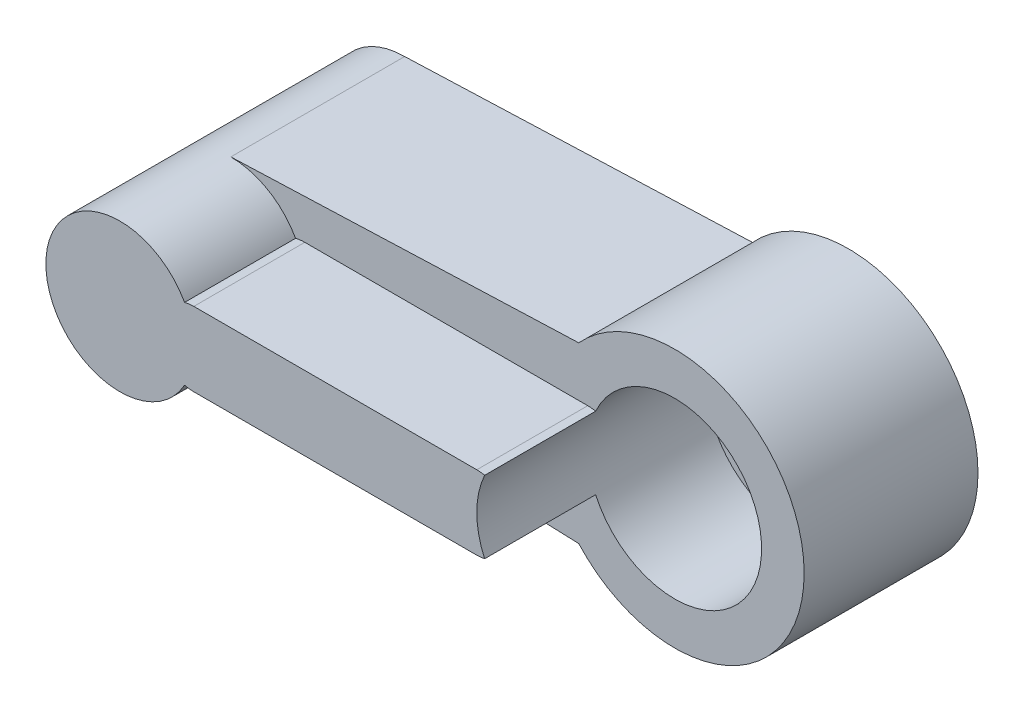
from build123d import *
from build123d.topology import SkipClean

# Parameters (mm, degrees)
SKETCH1_R           = 2.35
BOSS_EXTRUDE1_DEPTH = 6.7
BOSS_EXTRUDE2_DEPTH = 3
CUT_EXTRUDE1_DEPTH  = 2
SKETCH4_R           = 2.35
SKETCH4_R_2         = 1.45
BOSS_EXTRUDE3_DEPTH = 1.5


with BuildPart() as part:
    # Sketch1 → Boss-Extrude1 (new body)
    with BuildSketch(Plane.XY):
        with BuildLine():
            Line((-1.533260445, 2.35), (-10.939517975, 2))
            ThreePointArc((-10.939517975, 2), (-12.939517975, 0), (-10.939517975, -2))
            Line((-10.939517975, -2), (-1.533260445, -2.35))
            ThreePointArc((-1.533260445, -2.35), (4.560482025, 0), (-1.533260445, 2.35))
        make_face()
        with Locations((1.060482025, 0)):
            Circle(SKETCH1_R, mode=Mode.SUBTRACT)
    extrude(amount=BOSS_EXTRUDE1_DEPTH)

    # Sketch2 → Boss-Extrude2 (add)
    with SkipClean():  # the faces are left unmerged after this step: merging them gives an invalid solid
        with BuildSketch(Plane.XY.offset(6.7)):
            with BuildLine():
                Line((-8.939517975, 1), (-1.289517975, 1))
                ThreePointArc((-1.289517975, 1), (-1.18252076, 0.99425932), (-1.076752018, 0.977103192))
                ThreePointArc((-1.076752018, 0.977103192), (-1.289517975, 0), (-1.076752018, -0.977103192))
                ThreePointArc((-1.076752018, -0.977103192), (-1.18252076, -0.99425932), (-1.289517975, -1))
                Line((-1.289517975, -1), (-8.939517975, -1))
                ThreePointArc((-8.939517975, -1), (-9.065522268, -0.992029696), (-9.189517975, -0.968245837))
                ThreePointArc((-9.189517975, -0.968245837), (-12.939517975, 0), (-9.189517975, 0.968245837))
                ThreePointArc((-9.189517975, 0.968245837), (-9.065522268, 0.992029696), (-8.939517975, 1))
            make_face()
        extrude(amount=BOSS_EXTRUDE2_DEPTH)

    # Sketch3 → Cut-Extrude1 (cut)
    with SkipClean():  # the faces are left unmerged after this step: merging them gives an invalid solid
        with BuildSketch(Plane(origin=(0, 0, 0), x_dir=(-1, 0, 0), z_dir=(0, 0, -1))):
            with BuildLine():
                Line((10.939517975, 2), (1.533260445, 2.35))
                ThreePointArc((1.533260445, 2.35), (-4.560482025, 0), (1.533260445, -2.35))
                Line((1.533260445, -2.35), (10.939517975, -2))
                ThreePointArc((10.939517975, -2), (12.939517975, 0), (10.939517975, 2))
            make_face()
        extrude(amount=-CUT_EXTRUDE1_DEPTH, mode=Mode.SUBTRACT)

    # Sketch4 → Boss-Extrude3 (add)
    with SkipClean():  # the faces are left unmerged after this step: merging them gives an invalid solid
        with BuildSketch(Plane(origin=(0, 0, 2), x_dir=(-1, 0, 0), z_dir=(0, 0, -1))):
            with Locations((-1.060482025, 0)):
                Circle(SKETCH4_R)
            with Locations((-1.060482025, 0)):
                Circle(SKETCH4_R_2, mode=Mode.SUBTRACT)
        extrude(amount=-BOSS_EXTRUDE3_DEPTH)


solid = part.part
